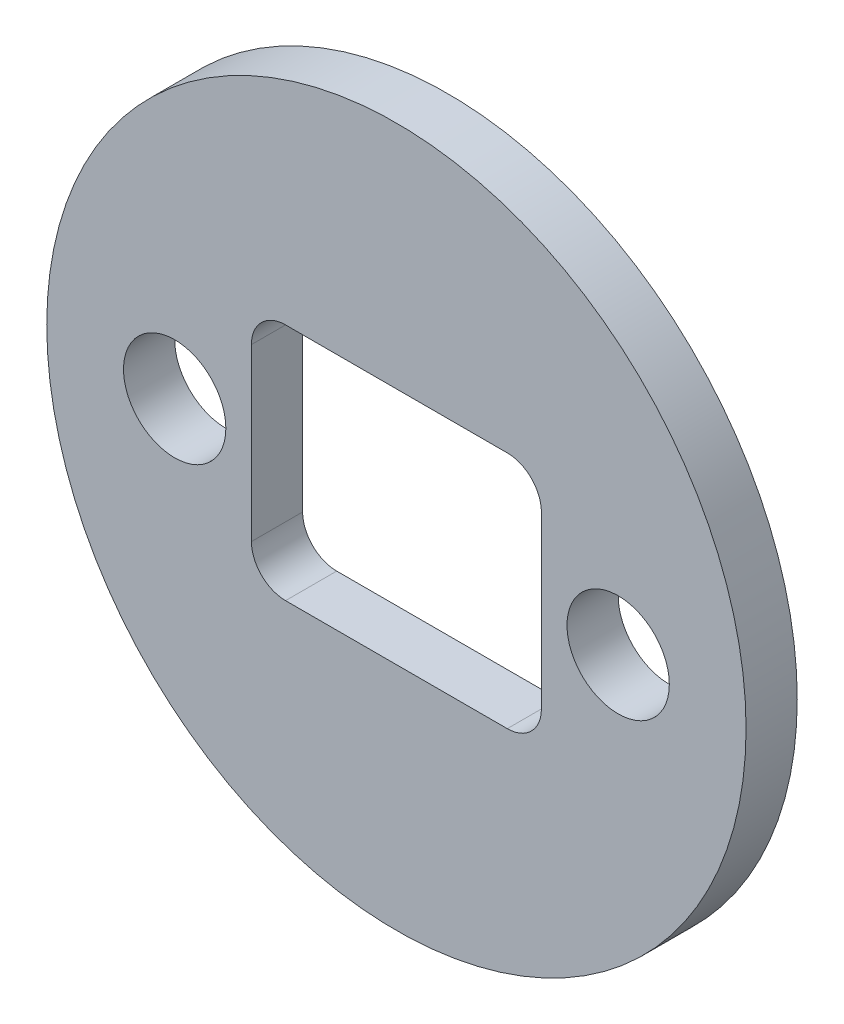
from build123d import *

# Parameters (mm, degrees)
SKETCH1_R           = 20.5
SKETCH1_R_2         = 3
SKETCH1_W           = 17
SKETCH1_H           = 14
BOSS_EXTRUDE1_DEPTH = 3
FILLET1_R           = 2


with BuildPart() as part:
    # Sketch1 → Boss-Extrude1 (new body)
    with BuildSketch(Plane.XY):
        Circle(SKETCH1_R)
        with Locations((-13, 0)):
            Circle(SKETCH1_R_2, mode=Mode.SUBTRACT)
        with Locations((13, 0)):
            Circle(SKETCH1_R_2, mode=Mode.SUBTRACT)
        Rectangle(SKETCH1_W, SKETCH1_H, mode=Mode.SUBTRACT)
    extrude(amount=BOSS_EXTRUDE1_DEPTH)

    # Fillet1
    fillet1_edges = [part.edges().sort_by_distance(p)[0] for p in [
        (-8.5, -7, 1.5),
        (8.5, -7, 1.5),
        (-8.5, 7, 1.5),
        (8.5, 7, 1.5),
    ]]
    fillet(fillet1_edges, radius=FILLET1_R)


solid = part.part
